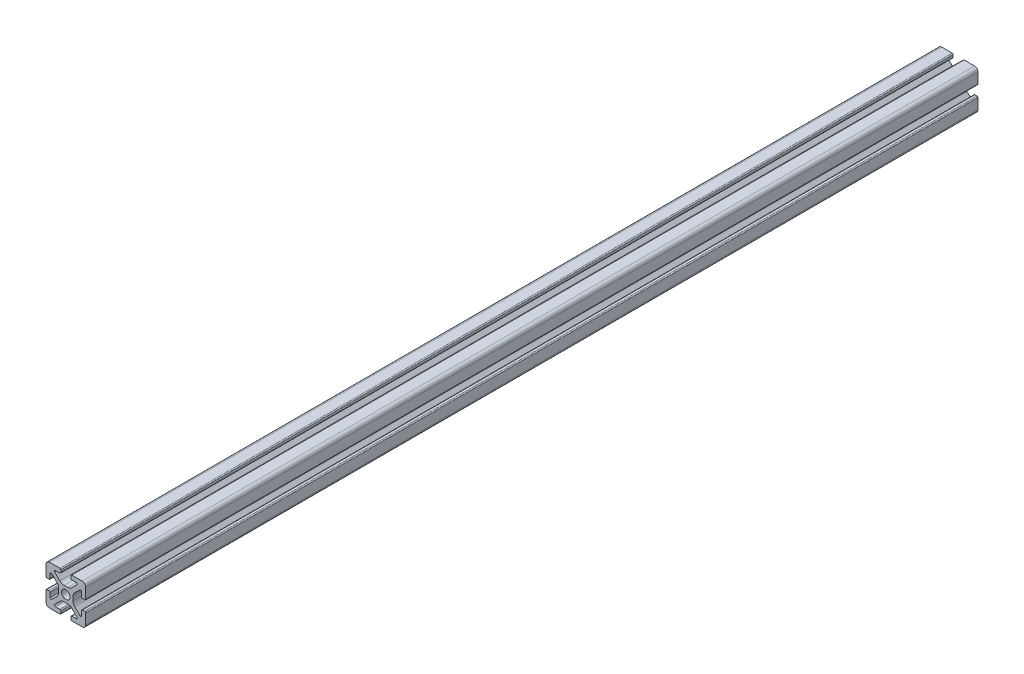
from build123d import *

# Parameters (mm, degrees)
BOSS_EXTRUDE1_DEPTH = 225


with BuildPart() as part:
    # Sketch4 → Boss-Extrude1 (new, symmetric)
    with BuildSketch(Plane.XY):
        with BuildLine():
            Line((3, -10), (8.25, -10))
            ThreePointArc((8.25, -10), (9.487436867, -9.487436867), (10, -8.25))
            Line((10, -8.25), (10, -3))
            ThreePointArc((10, -3), (9.853553391, -2.646446609), (9.5, -2.5))
            Line((9.5, -2.5), (8.424621202, -2.5))
            ThreePointArc((8.424621202, -2.5), (8.071067812, -2.646446609), (7.924621202, -3))
            Line((7.924621202, -3), (7.924621202, -5.25))
            ThreePointArc((7.924621202, -5.25), (7.615962919, -5.711939766), (7.071067812, -5.603553391))
            Line((7.071067812, -5.603553391), (4.478679656, -3.011165235))
            ThreePointArc((4.478679656, -3.011165235), (3.828361402, -2.037895189), (3.6, -0.889844892))
            Line((3.6, -0.889844892), (3.6, 0))
            Line((3.6, 0), (2.15, 0))
            ThreePointArc((2.15, 0), (1.52027958, -1.52027958), (0, -2.15))
            Line((0, -2.15), (0, -3.6))
            Line((0, -3.6), (0.889844892, -3.6))
            ThreePointArc((0.889844892, -3.6), (2.037895189, -3.828361402), (3.011165235, -4.478679656))
            Line((3.011165235, -4.478679656), (5.603553391, -7.071067812))
            ThreePointArc((5.603553391, -7.071067812), (5.711939766, -7.615962919), (5.25, -7.924621202))
            Line((5.25, -7.924621202), (3, -7.924621202))
            ThreePointArc((3, -7.924621202), (2.646446609, -8.071067812), (2.5, -8.424621202))
            Line((2.5, -8.424621202), (2.5, -9.5))
            ThreePointArc((2.5, -9.5), (2.646446609, -9.853553391), (3, -10))
        make_face()
    extrude(amount=BOSS_EXTRUDE1_DEPTH, both=True)

    # Mirror1: part across plane


with BuildPart() as part_1:
    add(part.part)
    add(part.part.mirror(Plane(origin=(0, 0, 0), x_dir=(0, 0, 1), z_dir=(1, 0, 0))))

    # Mirror2: part across plane


with BuildPart() as part_2:
    add(part_1.part)
    add(part_1.part.mirror(Plane.ZX))


solid = part_2.part
